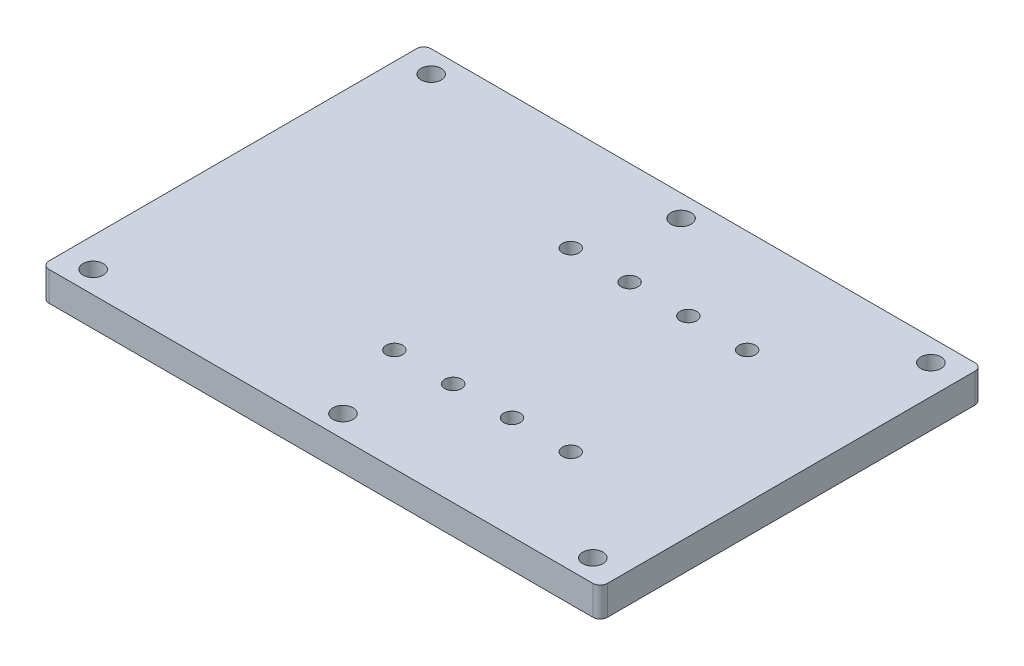
from build123d import *

# Parameters (mm, degrees)
SKETCH1_W               = 482.6
SKETCH1_H               = 330.2
BOSS_EXTRUDE1_DEPTH     = 25.4
CUT_EXTRUDE1_DEPTH      = 294.477188211
CUT_EXTRUDE1_DEPTH_BACK = 294.477188211
SKETCH2_R               = 8.7376
CUT_EXTRUDE2_DEPTH      = 294.477188211
CUT_EXTRUDE2_DEPTH_BACK = 294.477188211
SKETCH4_R               = 7.1628
FILLET1_R               = 6.35


with BuildPart() as part:
    # Sketch1 → Boss-Extrude1 (new body)
    with BuildSketch(Plane(origin=(0, 0, 0), x_dir=(1, 0, 0), z_dir=(0, 1, 0))):
        Rectangle(SKETCH1_W, SKETCH1_H)
    extrude(amount=BOSS_EXTRUDE1_DEPTH)

    # Sketch2 → Cut-Extrude1 (cut, two sides: drawn at the far end of the back side and taken through both)
    with BuildSketch(Plane(origin=(0, 25.4, 0), x_dir=(1, 0, 0), z_dir=(0, 1, 0)).offset(-CUT_EXTRUDE1_DEPTH_BACK)):
        with Locations(Location((215.9, 146.05, 0), (0, 0, 270))):
            Circle(SKETCH2_R)
        with Locations(Location((-215.9, 146.05, 0), (0, 0, 270))):
            Circle(SKETCH2_R)
        with Locations(Location((215.9, -146.05, 0), (0, 0, 270))):
            Circle(SKETCH2_R)
        with Locations(Location((-215.9, -146.05, 0), (0, 0, 270))):
            Circle(SKETCH2_R)
        with Locations(Location((0, 146.05, 0), (0, 0, 270))):
            Circle(SKETCH2_R)
        with Locations(Location((0, -146.05, 0), (0, 0, 270))):
            Circle(SKETCH2_R)
    extrude(amount=CUT_EXTRUDE1_DEPTH + CUT_EXTRUDE1_DEPTH_BACK, mode=Mode.SUBTRACT)

    # Sketch4 → Cut-Extrude2 (cut, two sides: drawn at the far end of the back side and taken through both)
    with BuildSketch(Plane(origin=(0, 25.4, 0), x_dir=(1, 0, 0), z_dir=(0, 1, 0)).offset(-CUT_EXTRUDE2_DEPTH_BACK)):
        with Locations(Location((-25.4, 76.2, 0), (0, 0, 270))):
            Circle(SKETCH4_R)
        with Locations(Location((25.4, 76.2, 0), (0, 0, 270))):
            Circle(SKETCH4_R)
        with Locations(Location((76.2, 76.2, 0), (0, 0, 270))):
            Circle(SKETCH4_R)
        with Locations(Location((127, 76.2, 0), (0, 0, 270))):
            Circle(SKETCH4_R)
        with Locations(Location((127, -76.2, 0), (0, 0, 270))):
            Circle(SKETCH4_R)
        with Locations(Location((76.2, -76.2, 0), (0, 0, 270))):
            Circle(SKETCH4_R)
        with Locations(Location((25.4, -76.2, 0), (0, 0, 270))):
            Circle(SKETCH4_R)
        with Locations(Location((-25.4, -76.2, 0), (0, 0, 270))):
            Circle(SKETCH4_R)
    extrude(amount=CUT_EXTRUDE2_DEPTH + CUT_EXTRUDE2_DEPTH_BACK, mode=Mode.SUBTRACT)

    # Fillet1
    fillet1_edges = [part.edges().sort_by_distance(p)[0] for p in [
        (241.3, 12.7, 165.1),
        (-241.3, 12.7, 165.1),
        (-241.3, 12.7, -165.1),
        (241.3, 12.7, -165.1),
    ]]
    fillet(fillet1_edges, radius=FILLET1_R)


solid = part.part
